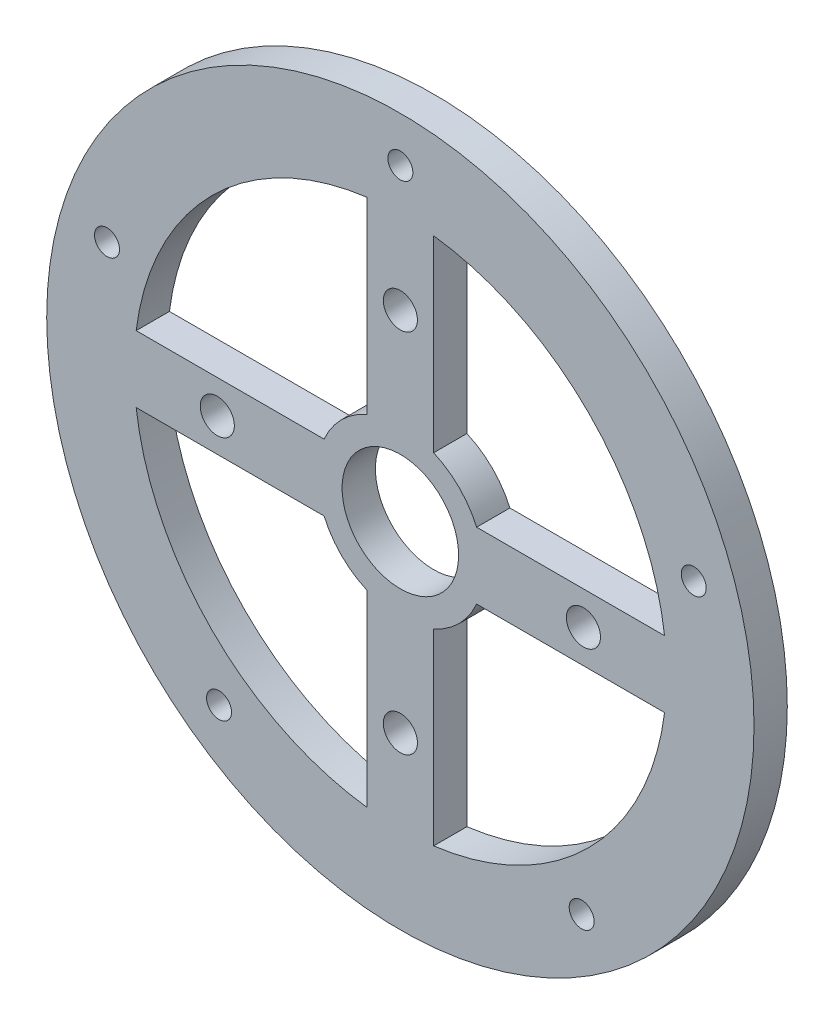
from build123d import *

# Parameters (mm, degrees)
SKETCH1_R           = 42.5
SKETCH1_R_2         = 32
SKETCH1_R_3         = 1.5
BOSS_EXTRUDE1_DEPTH = 4
SKETCH2_R           = 2.05
SKETCH2_R_2         = 7
BOSS_EXTRUDE2_DEPTH = 4


with BuildPart() as part:
    # Sketch1 → Boss-Extrude1 (new body)
    with BuildSketch(Plane.XY):
        Circle(SKETCH1_R)
        Circle(SKETCH1_R_2, mode=Mode.SUBTRACT)
        with Locations((0, 37.066662977)):
            Circle(SKETCH1_R_3, mode=Mode.SUBTRACT)
        with Locations((35.252491362, 11.454228785)):
            Circle(SKETCH1_R_3, mode=Mode.SUBTRACT)
        with Locations((21.78723785, -29.987560273)):
            Circle(SKETCH1_R_3, mode=Mode.SUBTRACT)
        with Locations((-21.78723785, -29.987560273)):
            Circle(SKETCH1_R_3, mode=Mode.SUBTRACT)
        with Locations((-35.252491362, 11.454228785)):
            Circle(SKETCH1_R_3, mode=Mode.SUBTRACT)
    extrude(amount=BOSS_EXTRUDE1_DEPTH)

    # Sketch2 → Boss-Extrude2 (add, through all)
    with BuildSketch(Plane.XY.offset(4)):
        with BuildLine():
            Line((-9.16515139, 4), (-31.749015733, 4))
            ThreePointArc((-31.749015733, 4), (-32, 0), (-31.749015733, -4))
            Line((-31.749015733, -4), (-9.16515139, -4))
            ThreePointArc((-9.16515139, -4), (-7.071067812, -7.071067812), (-4, -9.16515139))
            Line((-4, -9.16515139), (-4, -31.749015733))
            ThreePointArc((-4, -31.749015733), (0, -32), (4, -31.749015733))
            Line((4, -31.749015733), (4, -9.16515139))
            ThreePointArc((4, -9.16515139), (7.071067812, -7.071067812), (9.16515139, -4))
            Line((9.16515139, -4), (31.749015733, -4))
            ThreePointArc((31.749015733, -4), (32, 0), (31.749015733, 4))
            Line((31.749015733, 4), (9.16515139, 4))
            ThreePointArc((9.16515139, 4), (7.071067812, 7.071067812), (4, 9.16515139))
            Line((4, 9.16515139), (4, 31.749015733))
            ThreePointArc((4, 31.749015733), (0, 32), (-4, 31.749015733))
            Line((-4, 31.749015733), (-4, 9.16515139))
            ThreePointArc((-4, 9.16515139), (-7.071067812, 7.071067812), (-9.16515139, 4))
        make_face()
        with Locations((0, 22)):
            Circle(SKETCH2_R, mode=Mode.SUBTRACT)
        with Locations((22, 0)):
            Circle(SKETCH2_R, mode=Mode.SUBTRACT)
        with Locations((0, -22)):
            Circle(SKETCH2_R, mode=Mode.SUBTRACT)
        with Locations((-22, 0)):
            Circle(SKETCH2_R, mode=Mode.SUBTRACT)
        Circle(SKETCH2_R_2, mode=Mode.SUBTRACT)
    extrude(amount=-BOSS_EXTRUDE2_DEPTH)


solid = part.part
